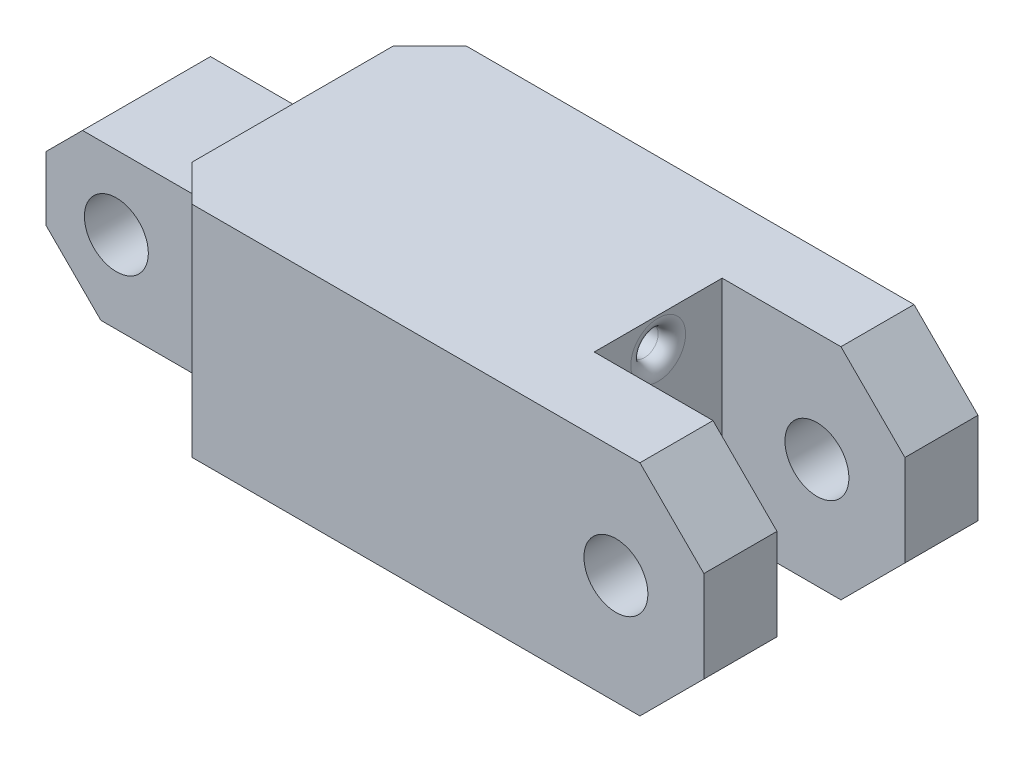
from build123d import *

# Parameters (mm, degrees)
SKETCH_2_W            = 15
SKETCH_2_H            = 12
EXTRUDE_1_DEPTH       = 40
SKETCH_3_W            = 13.345049732
SKETCH_3_H            = 6.461251269
CUT_EXTRUDE_1_DEPTH   = 43.429353047
SKETCH_4_R            = 1.75
CUT_EXTRUDE_2_DEPTH   = 42.91658383
SKETCH_5_W            = 15.367688112
SKETCH_5_H            = 7
CUT_EXTRUDE_2_2_DEPTH = 43.429353047
CHAMFER_4_SIZE        = 3.5
SKETCH_7_R            = 0.75
CUT_EXTRUDE_3_DEPTH   = 32.5
CHAMFER_5_SIZE        = 3
SKETCH_8_W            = 20.918678204
SKETCH_8_H            = 3.864211738
CUT_EXTRUDE_4_DEPTH   = 10
CHAMFER_6_SIZE        = 2
SKETCH_9_R            = 1.75
CUT_EXTRUDE_5_DEPTH   = 44.13930922
FILLET_6_R            = 0.75
CHAMFER_7_SIZE        = 2


with BuildPart() as part:
    # Эскиз2 → Вытянуть1 (new body)
    with BuildSketch(Plane(origin=(0, 0, 0), x_dir=(0, 0, -1), z_dir=(1, 0, 0))):
        Rectangle(SKETCH_2_W, SKETCH_2_H)
    extrude(amount=EXTRUDE_1_DEPTH)

    # Эскиз3 → Вырез-Вытянуть1 (cut, through all)
    with BuildSketch(Plane(origin=(0, 6, 0), x_dir=(1, 0, 0), z_dir=(0, 1, 0))):
        with Locations((3.327475134, -6.730625634)):
            Rectangle(SKETCH_3_W, SKETCH_3_H)
        with Locations((3.327475134, 6.730625634)):
            Rectangle(SKETCH_3_W, SKETCH_3_H)
    extrude(amount=-CUT_EXTRUDE_1_DEPTH, mode=Mode.SUBTRACT)

    # Эскиз4 → Cut-Extrude 2 (cut, through all)
    with BuildSketch(Plane.XY.offset(3.5)):
        with Locations((3.849904433, -1.520907782)):
            Circle(SKETCH_4_R)
    extrude(amount=-CUT_EXTRUDE_2_DEPTH, mode=Mode.SUBTRACT)

    # Эскиз5 → Cut-Extrude 2 2 (cut, through all)
    with BuildSketch(Plane(origin=(0, 6, 0), x_dir=(1, 0, 0), z_dir=(0, 1, 0))):
        with Locations((37.683844056, 0)):
            Rectangle(SKETCH_5_W, SKETCH_5_H)
    extrude(amount=-CUT_EXTRUDE_2_2_DEPTH, mode=Mode.SUBTRACT)

    # Фаска4
    chamfer_4_edges = [part.edges().sort_by_distance(p)[0] for p in [
        (40, -6, 5.5),
        (40, 6, 5.5),
        (40, -6, -5.5),
        (40, 6, -5.5),
    ]]
    chamfer(chamfer_4_edges, length=CHAMFER_4_SIZE)

    # Эскиз7 → Вытянуть3 (cut, through all)
    with BuildSketch(Plane(origin=(30, 0, 0), x_dir=(0, 0, -1), z_dir=(1, 0, 0))):
        with Locations((0, 4.357693323)):
            Circle(SKETCH_7_R)
    extrude(amount=-CUT_EXTRUDE_3_DEPTH, mode=Mode.SUBTRACT)

    # Фаска5
    chamfer_5_edges = [part.edges().sort_by_distance(p)[0] for p in [
        (0, -6, 0),
    ]]
    chamfer(chamfer_5_edges, length=CHAMFER_5_SIZE)

    # Эскиз8 → Вытянуть4 (cut)
    with BuildSketch(Plane.ZY):
        with Locations((-0.939401822, 4.432105869)):
            Rectangle(SKETCH_8_W, SKETCH_8_H)
    extrude(amount=-CUT_EXTRUDE_4_DEPTH, mode=Mode.SUBTRACT)

    # Фаска6
    chamfer_6_edges = [part.edges().sort_by_distance(p)[0] for p in [
        (0, 2.5, 0),
    ]]
    chamfer(chamfer_6_edges, length=CHAMFER_6_SIZE)

    # Эскиз9 → Вытянуть5 (cut, through all)
    with BuildSketch(Plane.XY.offset(7.5)):
        with Locations((35.185724632, 0)):
            Circle(SKETCH_9_R)
    extrude(amount=-CUT_EXTRUDE_5_DEPTH, mode=Mode.SUBTRACT)

    # Скругление6
    fillet_6_edges = [part.edges().sort_by_distance(p)[0] for p in [
        (30, 4.357693323, 0.75),
        (10, 4.357693323, 0.75),
    ]]
    fillet(fillet_6_edges, radius=FILLET_6_R)

    # Фаска7
    chamfer_7_edges = [part.edges().sort_by_distance(p)[0] for p in [
        (10, 0, -7.5),
        (10, 0, 7.5),
    ]]
    chamfer(chamfer_7_edges, length=CHAMFER_7_SIZE)


solid = part.part
